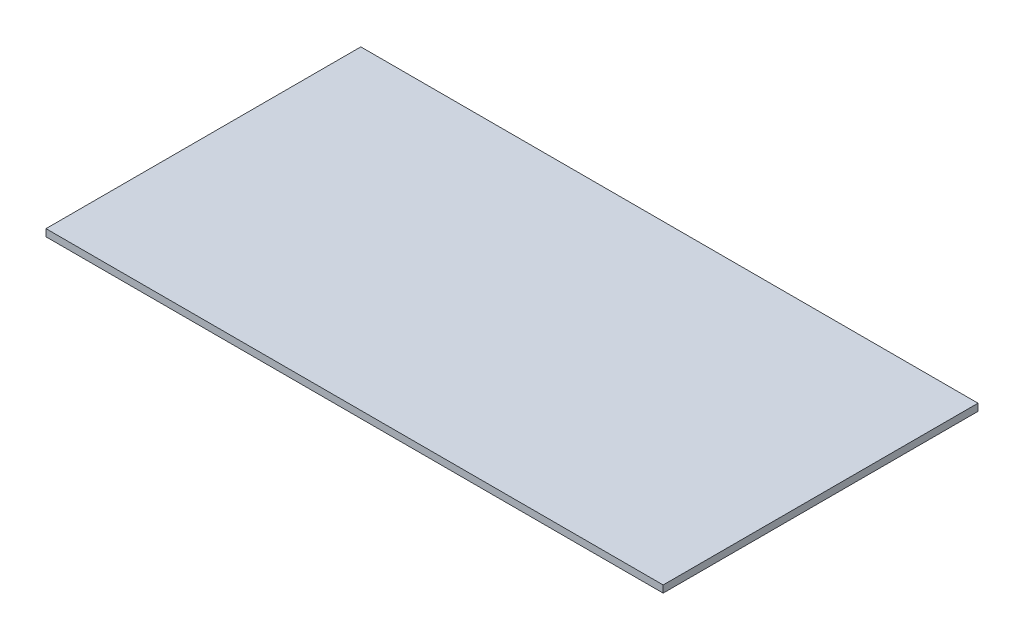
from build123d import *

# Parameters (mm, degrees)
SKETCH1_W           = 143.461104136
SKETCH1_H           = 73.18196899
BOSS_EXTRUDE1_DEPTH = 1.651


with BuildPart() as part:
    # Sketch1 → Boss-Extrude1 (new body)
    with BuildSketch(Plane(origin=(0, 0, 0), x_dir=(1, 0, 0), z_dir=(0, 1, 0))):
        with Locations((71.730552068, 36.590984495)):
            Rectangle(SKETCH1_W, SKETCH1_H)
    extrude(amount=BOSS_EXTRUDE1_DEPTH)


solid = part.part
